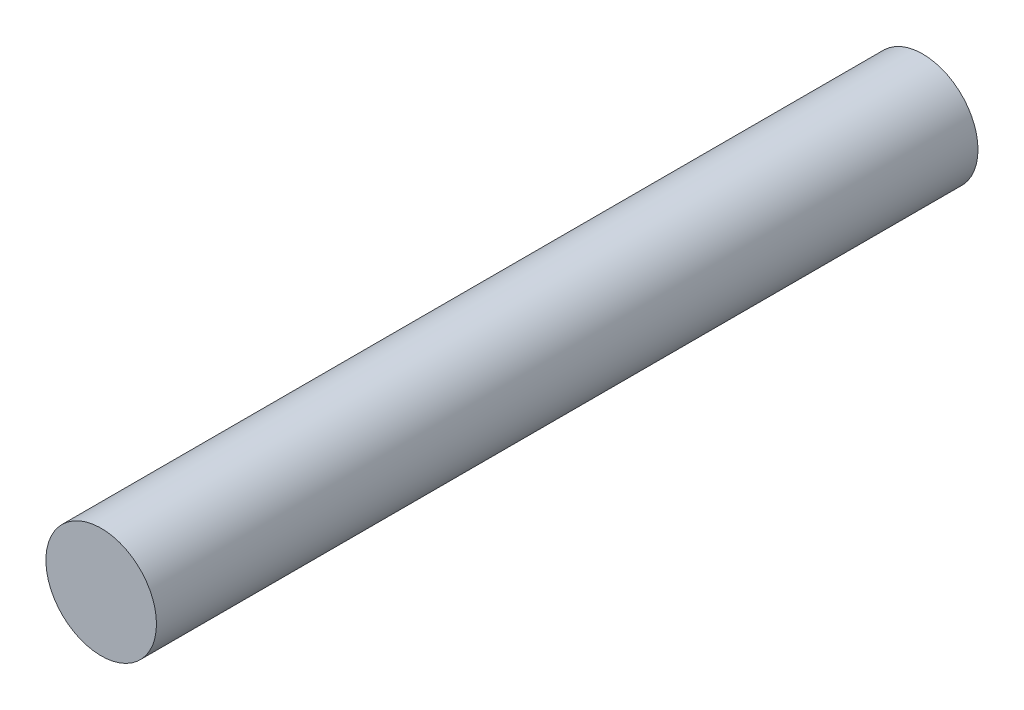
from build123d import *

# Parameters (mm, degrees)
SKETCH2_R             = 9.144
THICKER_SECTION_DEPTH = 135.89


with BuildPart() as part:
    # Sketch2 → Thicker Section (new body)
    with BuildSketch(Plane.XY):
        Circle(SKETCH2_R)
    extrude(amount=THICKER_SECTION_DEPTH)


solid = part.part
